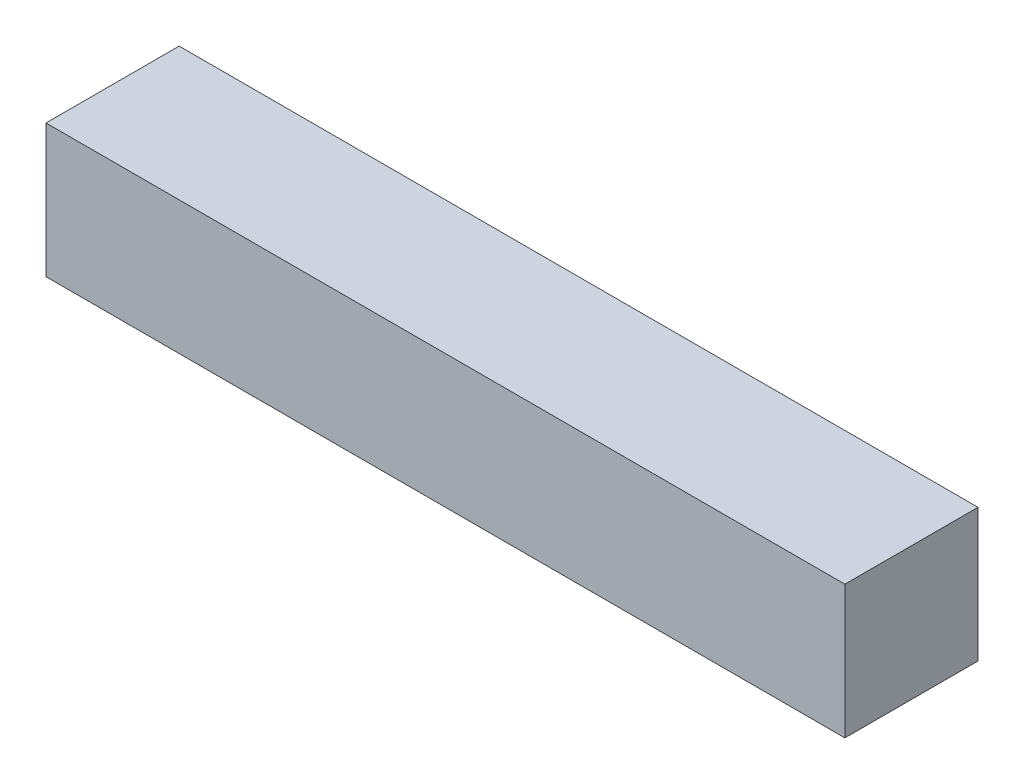
from build123d import *

# Parameters (mm, degrees)
ESQUISSE1_W        = 18
ESQUISSE1_H        = 3
BOSS_EXTRU_1_DEPTH = 3


with BuildPart() as part:
    # Esquisse1 → Boss.-Extru.1 (new body)
    with BuildSketch(Plane.XY):
        Rectangle(ESQUISSE1_W, ESQUISSE1_H)
    extrude(amount=BOSS_EXTRU_1_DEPTH)


solid = part.part
